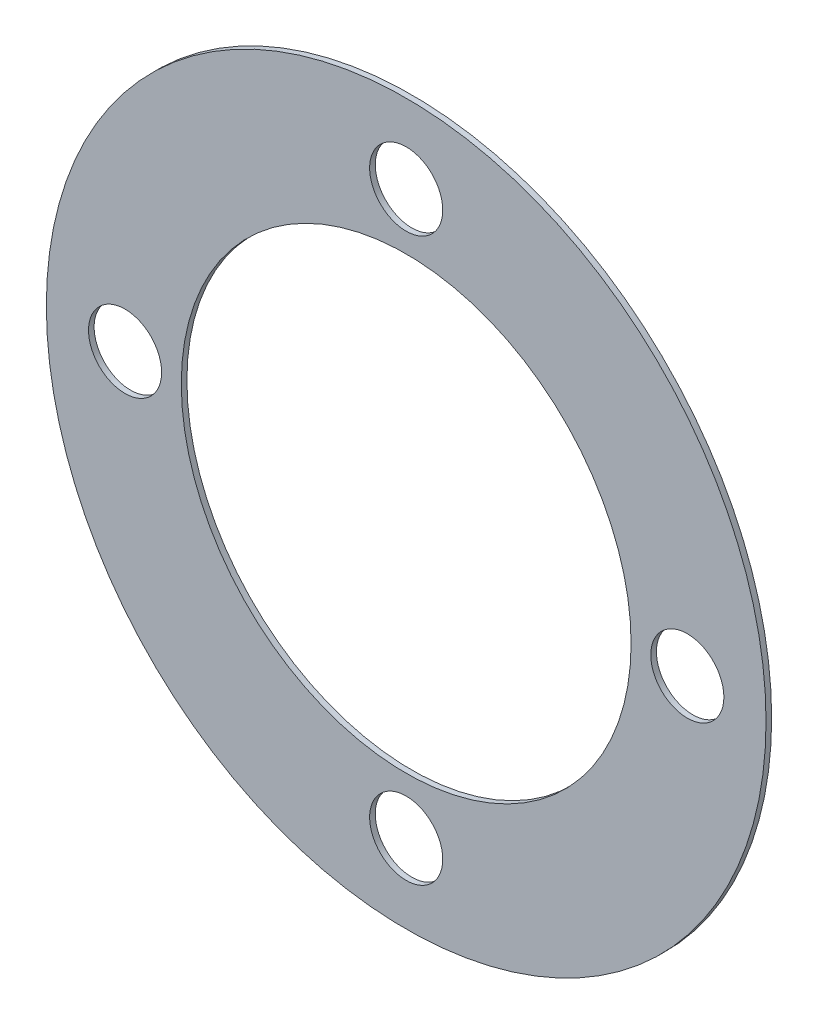
from build123d import *

# Parameters (mm, degrees)
SKETCH1_R           = 32
SKETCH1_R_2         = 20
SKETCH1_R_3         = 3.25
BOSS_EXTRUDE1_DEPTH = 0.5


with BuildPart() as part:
    # Sketch1 → Boss-Extrude1 (new body)
    with BuildSketch(Plane.XY):
        Circle(SKETCH1_R)
        Circle(SKETCH1_R_2, mode=Mode.SUBTRACT)
        with Locations((0, 25)):
            Circle(SKETCH1_R_3, mode=Mode.SUBTRACT)
        with Locations((25, 0)):
            Circle(SKETCH1_R_3, mode=Mode.SUBTRACT)
        with Locations((0, -25)):
            Circle(SKETCH1_R_3, mode=Mode.SUBTRACT)
        with Locations((-25, 0)):
            Circle(SKETCH1_R_3, mode=Mode.SUBTRACT)
    extrude(amount=BOSS_EXTRUDE1_DEPTH)


solid = part.part
